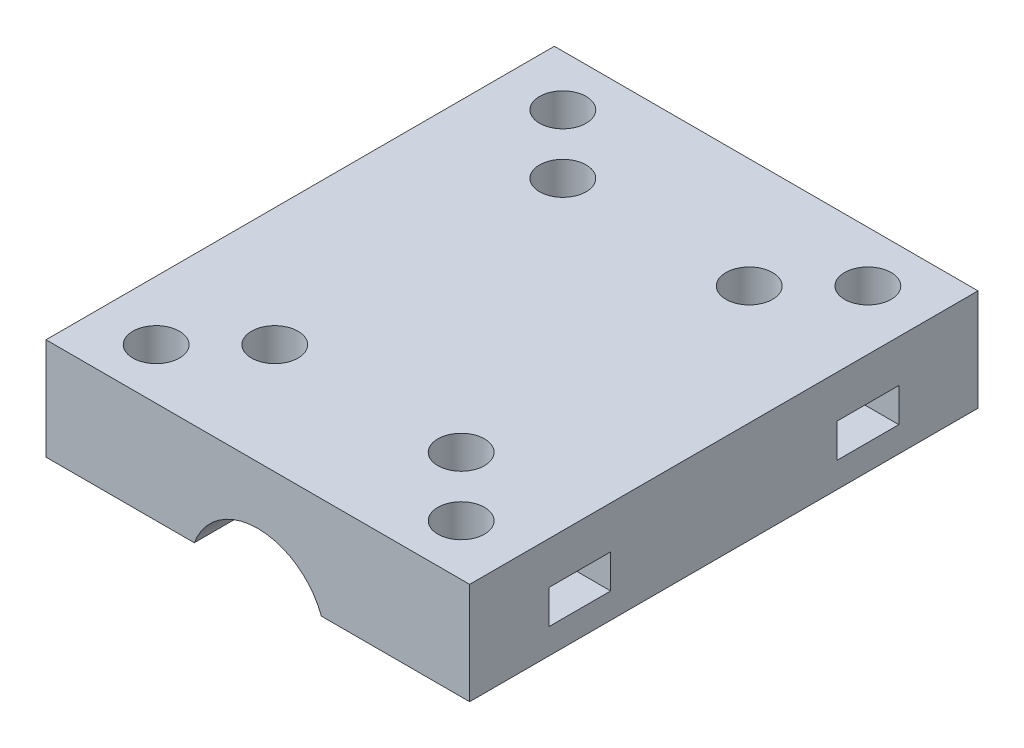
from build123d import *

# Parameters (mm, degrees)
SKETCH1_W                      = 50
SKETCH1_H                      = 60
BOSS_EXTRUDE1_DEPTH            = 12
CUT_EXTRUDE1_DEPTH             = 80.018985061
F_5_5_5_5_DIAMETER_HOLE1_D     = 5.5
F_5_5_5_5_DIAMETER_HOLE1_DEPTH = 30
F_5_5_5_5_DIAMETER_HOLE1_TIP   = 1.652366702
SKETCH5_W                      = 7.3
SKETCH5_H                      = 4
CUT_EXTRUDE2_DEPTH             = 17.3
SKETCH6_W                      = 7.3
SKETCH6_H                      = 4
CUT_EXTRUDE3_DEPTH             = 17.3
F_5_5_5_5_DIAMETER_HOLE2_D     = 5.5


with BuildPart() as part:
    # Sketch1 → Boss-Extrude1 (new body)
    with BuildSketch(Plane(origin=(0, 0, 0), x_dir=(1, 0, 0), z_dir=(0, 1, 0))):
        with Locations((25, 30)):
            Rectangle(SKETCH1_W, SKETCH1_H)
    extrude(amount=BOSS_EXTRUDE1_DEPTH)

    # Sketch2 → Cut-Extrude1 (cut, through all)
    with BuildSketch(Plane.XY):
        with BuildLine():
            Line((17.5, 0), (32.5, 0))
            ThreePointArc((32.5, 0), (25, 5.216117819), (17.5, 0))
        make_face()
    extrude(amount=-CUT_EXTRUDE1_DEPTH, mode=Mode.SUBTRACT)

    # Ø5.5 (5.5) Diameter Hole1
    with Locations(Plane.XZ):
        with Locations((14, -13), (36, -13), (14, -47), (36, -47)):
            Hole(F_5_5_5_5_DIAMETER_HOLE1_D / 2, depth=F_5_5_5_5_DIAMETER_HOLE1_DEPTH)
            with Locations((0, 0, -(F_5_5_5_5_DIAMETER_HOLE1_DEPTH + F_5_5_5_5_DIAMETER_HOLE1_TIP / 2))):  # 118° drill point
                Cone(0, F_5_5_5_5_DIAMETER_HOLE1_D / 2, F_5_5_5_5_DIAMETER_HOLE1_TIP, mode=Mode.SUBTRACT)

    # Sketch5 → Cut-Extrude2 (cut)
    with BuildSketch(Plane.ZY):
        with Locations((-47, 5)):
            Rectangle(SKETCH5_W, SKETCH5_H)
        with Locations((-13, 5)):
            Rectangle(SKETCH5_W, SKETCH5_H)
    extrude(amount=-CUT_EXTRUDE2_DEPTH, mode=Mode.SUBTRACT)

    # Sketch6 → Cut-Extrude3 (cut)
    with BuildSketch(Plane(origin=(50, 0, 0), x_dir=(0, 0, -1), z_dir=(1, 0, 0))):
        with Locations((13, 5)):
            Rectangle(SKETCH6_W, SKETCH6_H)
        with Locations((47, 5)):
            Rectangle(SKETCH6_W, SKETCH6_H)
    extrude(amount=-CUT_EXTRUDE3_DEPTH, mode=Mode.SUBTRACT)

    # Ø5.5 (5.5) Diameter Hole2 (through all)
    with Locations(Plane(origin=(0, 12, 0), x_dir=(-1, 0, 0), z_dir=(0, 1, 0))):
        with Locations((-43, -6), (-7, -6), (-7, -54), (-43, -54)):
            Hole(F_5_5_5_5_DIAMETER_HOLE2_D / 2)


solid = part.part
